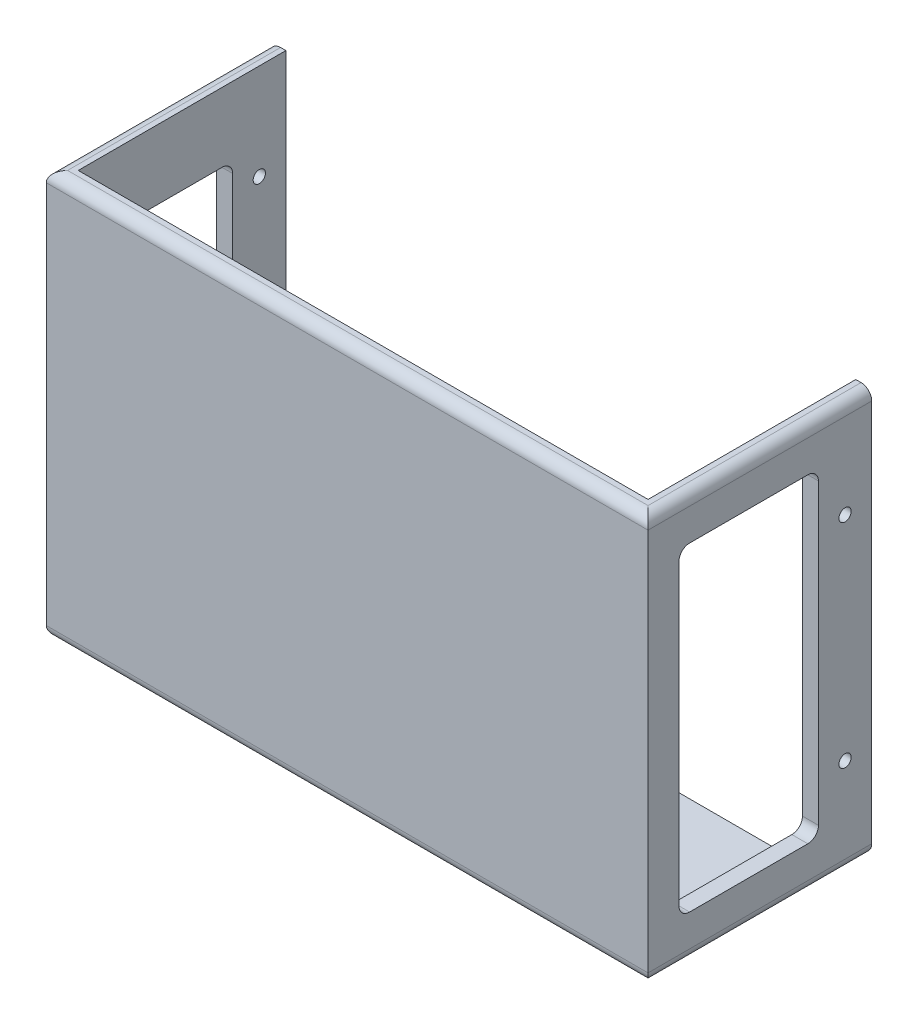
from build123d import *

# Parameters (mm, degrees)
SKETCH_1_W          = 113
SKETCH_1_H          = 76
SKETCH_1_W_2        = 107
SKETCH_1_H_2        = 70
EXTRUDE_1_DEPTH     = 40
SKETCH_2_W          = 113
SKETCH_2_H          = 76
EXTRUDE_2_DEPTH     = 2
SKETCH_3_R          = 1.05
CUT_EXTRUDE_1_DEPTH = 127.400158228
SKETCH_6_W          = 60
SKETCH_6_H          = 30
CUT_EXTRUDE_2_DEPTH = 102.416221582
SKETCH_7_W          = 107
SKETCH_7_H          = 8.791278805
CUT_EXTRUDE_3_DEPTH = 102.416221582
SKETCH_9_W          = 26.200451213
SKETCH_9_H          = 60
CUT_EXTRUDE_4_DEPTH = 3
SKETCH_10_W         = 30
SKETCH_10_H         = 50
CUT_EXTRUDE_5_DEPTH = 3
SKETCH_13_W         = 107
SKETCH_13_H         = 40
CUT_EXTRUDE_6_DEPTH = 3
SKETCH_17_W         = 113
SKETCH_17_H         = 76
EXTRUDE_4_DEPTH     = 1
SKETCH_18_W         = 107
SKETCH_18_H         = 3
CUT_EXTRUDE_7_DEPTH = 2
FILLET_1_R          = 2
SKETCH_19_R         = 1.15
CUT_EXTRUDE_8_DEPTH = 127.400158228


with BuildPart() as part:
    # 草图1 → 凸台-拉伸1 (new body)
    with BuildSketch(Plane.XY):
        Rectangle(SKETCH_1_W, SKETCH_1_H)
        Rectangle(SKETCH_1_W_2, SKETCH_1_H_2, mode=Mode.SUBTRACT)
    extrude(amount=EXTRUDE_1_DEPTH)

    # 草图2 → 凸台-拉伸2 (add)
    with BuildSketch(Plane.XY.offset(40)):
        Rectangle(SKETCH_2_W, SKETCH_2_H)
    extrude(amount=EXTRUDE_2_DEPTH)

    # 草图3 → 切除-拉伸1 (cut, through all)
    with BuildSketch(Plane.ZY.offset(56.5)):
        with Locations((5, 20)):
            Circle(SKETCH_3_R)
        with Locations(Location((5, -20, 0), (0, 0, 180))):
            Circle(SKETCH_3_R)
    extrude(amount=-CUT_EXTRUDE_1_DEPTH, mode=Mode.SUBTRACT)

    # 草图6 → 切除-拉伸2 (cut, through all)
    with BuildSketch(Plane.XZ.offset(-35)):
        with Locations((-23.5, 15)):
            Rectangle(SKETCH_6_W, SKETCH_6_H)
    extrude(amount=-CUT_EXTRUDE_2_DEPTH, mode=Mode.SUBTRACT)

    # 草图7 → 切除-拉伸3 (cut, through all)
    with BuildSketch(Plane(origin=(0, -35, 0), x_dir=(1, 0, 0), z_dir=(0, 1, 0))):
        with Locations((0, -4.395639403)):
            Rectangle(SKETCH_7_W, SKETCH_7_H)
    extrude(amount=-CUT_EXTRUDE_3_DEPTH, mode=Mode.SUBTRACT)

    # 草图9 → 切除-拉伸4 (cut)
    with BuildSketch(Plane(origin=(56.5, 0, 0), x_dir=(0, 0, -1), z_dir=(1, 0, 0))):
        with Locations((-23.100225607, 0)):
            Rectangle(SKETCH_9_W, SKETCH_9_H)
    extrude(amount=-CUT_EXTRUDE_4_DEPTH, mode=Mode.SUBTRACT)

    # 草图10 → 切除-拉伸5 (cut)
    with BuildSketch(Plane.ZY.offset(56.5)):
        with Locations((25, 0)):
            Rectangle(SKETCH_10_W, SKETCH_10_H)
    extrude(amount=-CUT_EXTRUDE_5_DEPTH, mode=Mode.SUBTRACT)

    # 草图13 → 切除-拉伸6 (cut)
    with BuildSketch(Plane(origin=(0, 38, 0), x_dir=(1, 0, 0), z_dir=(0, 1, 0))):
        with Locations((0, -20)):
            Rectangle(SKETCH_13_W, SKETCH_13_H)
    extrude(amount=-CUT_EXTRUDE_6_DEPTH, mode=Mode.SUBTRACT)

    # 草图17 → 凸台-拉伸4 (add)
    with BuildSketch(Plane(origin=(0, 0, 40), x_dir=(-1, 0, 0), z_dir=(0, 0, -1))):
        Rectangle(SKETCH_17_W, SKETCH_17_H)
    extrude(amount=EXTRUDE_4_DEPTH)

    # 草图18 → 切除-拉伸7 (cut)
    with BuildSketch(Plane(origin=(0, 0, 8.791278805), x_dir=(-1, 0, 0), z_dir=(0, 0, -1))):
        with Locations((0, -36.5)):
            Rectangle(SKETCH_18_W, SKETCH_18_H)
    extrude(amount=-CUT_EXTRUDE_7_DEPTH, mode=Mode.SUBTRACT)

    # 圆角1
    fillet_1_edges = [part.edges().sort_by_distance(p)[0] for p in [
        (-55, -25, 10),
        (-55, 25, 10),
        (-55, 25, 39),
        (-55, -25, 39),
        (0, -38, 42),
        (0, 38, 42),
        (-56.5, 38, 21),
        (56.5, 38, 21),
        (56.5, -38, 21),
        (-56.5, -38, 21),
        (55, 30, 36.200451213),
        (55, 30, 10),
        (55, -30, 10),
        (55, -30, 36.200451213),
    ]]
    fillet(fillet_1_edges, radius=FILLET_1_R)

    # 草图19 → 切除-拉伸8 (cut, through all)
    with BuildSketch(Plane(origin=(56.5, 0, 0), x_dir=(0, 0, -1), z_dir=(1, 0, 0))):
        with Locations((-5, 20)):
            Circle(SKETCH_19_R)
        with Locations((-5, -20)):
            Circle(SKETCH_19_R)
    extrude(amount=-CUT_EXTRUDE_8_DEPTH, mode=Mode.SUBTRACT)


solid = part.part
